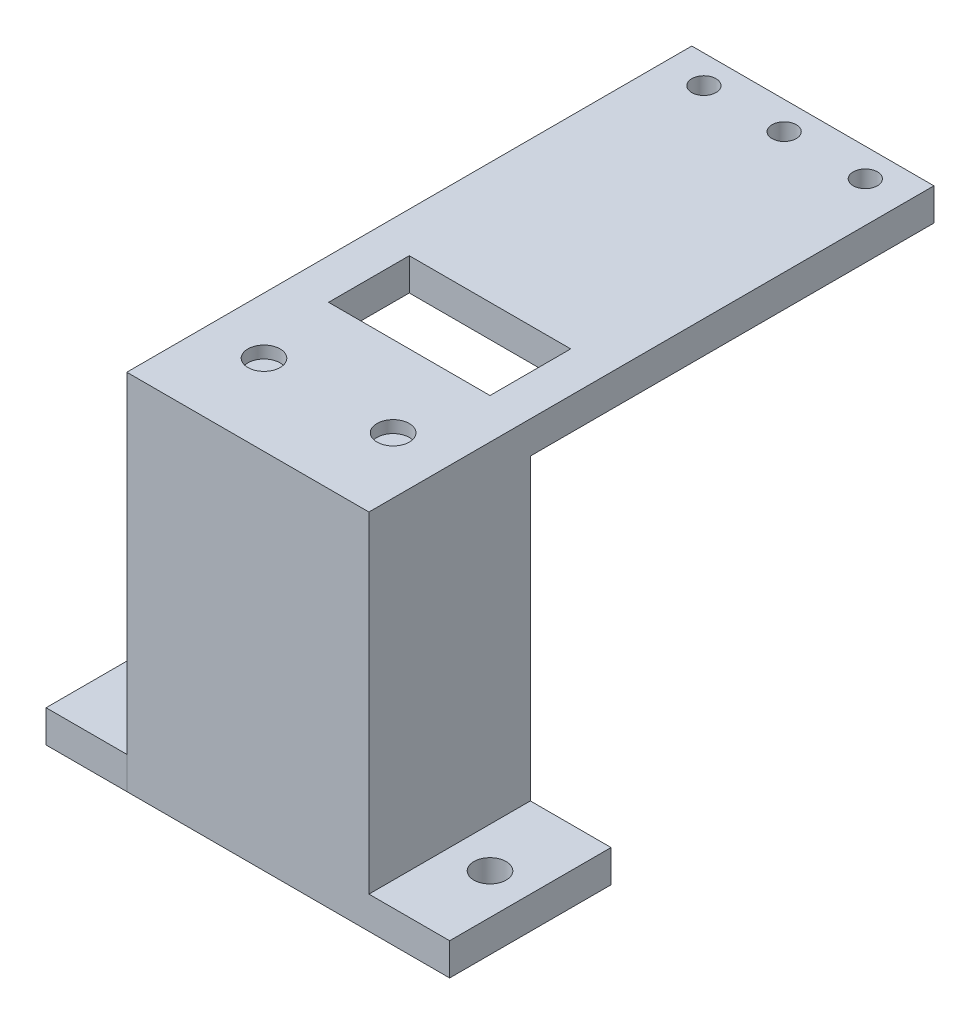
from build123d import *

# Parameters (mm, degrees)
SKETCH1_W           = 30
SKETCH1_H           = 20
BOSS_EXTRUDE1_DEPTH = 45
SKETCH3_W           = 10
SKETCH3_H           = 20
BOSS_EXTRUDE2_DEPTH = 4
SKETCH4_W           = 10
SKETCH4_H           = 20
BOSS_EXTRUDE3_DEPTH = 4
SKETCH5_R           = 2
CUT_EXTRUDE2_DEPTH  = 4
SKETCH8_R           = 2
CUT_EXTRUDE3_DEPTH  = 1.5
SKETCH9_W           = 30
SKETCH9_H           = 4
BOSS_EXTRUDE4_DEPTH = 50
SKETCH10_W          = 20
SKETCH10_H          = 10
CUT_EXTRUDE4_DEPTH  = 4
SKETCH11_R          = 1.5
CUT_EXTRUDE5_DEPTH  = 4


with BuildPart() as part:
    # Sketch1 → Boss-Extrude1 (new body)
    with BuildSketch(Plane(origin=(0, 0, 0), x_dir=(1, 0, 0), z_dir=(0, 1, 0))):
        with Locations((15, 10)):
            Rectangle(SKETCH1_W, SKETCH1_H)
    extrude(amount=BOSS_EXTRUDE1_DEPTH)

    # Sketch3 → Boss-Extrude2 (add)
    with BuildSketch(Plane.XZ):
        with Locations((35, -10)):
            Rectangle(SKETCH3_W, SKETCH3_H)
    extrude(amount=-BOSS_EXTRUDE2_DEPTH)


with BuildPart() as body_2:
    # Sketch4 → Boss-Extrude3 (new body)
    with BuildSketch(Plane(origin=(0, 0, 0), x_dir=(-1, 0, 0), z_dir=(0, -1, 0))):
        with Locations((5, 10)):
            Rectangle(SKETCH4_W, SKETCH4_H)
    extrude(amount=-BOSS_EXTRUDE3_DEPTH)


with BuildPart() as cut_extrude2_tool:
    # Sketch5 → Cut-Extrude2 (new body)
    with BuildSketch(Plane.XZ):
        with Locations(Location((35, -10, 0), (0, 0, 270))):
            Circle(SKETCH5_R)
        with Locations(Location((-5, -10, 0), (0, 0, 270))):
            Circle(SKETCH5_R)
    extrude(amount=-CUT_EXTRUDE2_DEPTH)


with BuildPart() as part_1:
    add(part.part)

    # Cut-Extrude2: cut by cut_extrude2_tool
    add(cut_extrude2_tool.part, mode=Mode.SUBTRACT)

    # Sketch8 → Cut-Extrude3 (cut)
    with BuildSketch(Plane(origin=(0, 45, 0), x_dir=(1, 0, 0), z_dir=(0, 1, 0))):
        with Locations(Location((7, 10, 0), (0, 0, 270))):
            Circle(SKETCH8_R)
        with Locations(Location((23, 10, 0), (0, 0, 270))):
            Circle(SKETCH8_R)
    extrude(amount=-CUT_EXTRUDE3_DEPTH, mode=Mode.SUBTRACT)

    # Sketch9 → Boss-Extrude4 (add)
    with BuildSketch(Plane(origin=(0, 0, -20), x_dir=(-1, 0, 0), z_dir=(0, 0, -1))):
        with Locations((-15, 43)):
            Rectangle(SKETCH9_W, SKETCH9_H)
    extrude(amount=BOSS_EXTRUDE4_DEPTH)

    # Sketch10 → Cut-Extrude4 (cut)
    with BuildSketch(Plane(origin=(0, 45, 0), x_dir=(1, 0, 0), z_dir=(0, 1, 0))):
        with Locations((15, 25)):
            Rectangle(SKETCH10_W, SKETCH10_H)
    extrude(amount=-CUT_EXTRUDE4_DEPTH, mode=Mode.SUBTRACT)

    # Sketch11 → Cut-Extrude5 (cut)
    with BuildSketch(Plane(origin=(0, 45, 0), x_dir=(1, 0, 0), z_dir=(0, 1, 0))):
        with Locations(Location((25, 66.5, 0), (0, 0, 270))):
            Circle(SKETCH11_R)
        with Locations(Location((14.911615562, 66.532901833, 0), (0, 0, 270))):
            Circle(SKETCH11_R)
        with Locations(Location((5, 66.5, 0), (0, 0, 270))):
            Circle(SKETCH11_R)
    extrude(amount=-CUT_EXTRUDE5_DEPTH, mode=Mode.SUBTRACT)


with BuildPart() as body_2_1:
    add(body_2.part)

    # Cut-Extrude2: cut by cut_extrude2_tool
    add(cut_extrude2_tool.part, mode=Mode.SUBTRACT)


solid = Compound([part_1.part, body_2_1.part])
